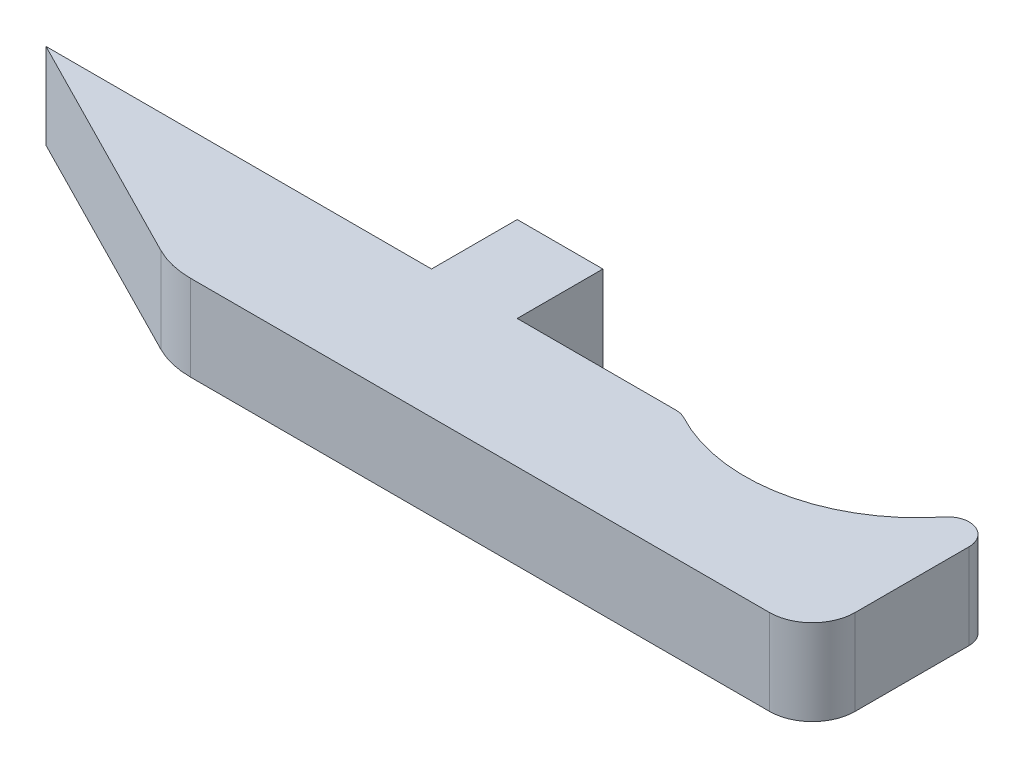
from build123d import *

# Parameters (mm, degrees)
BOSS_EXTRUDE1_DEPTH = 6.35
FILLET1_R           = 1.5875
FILLET2_R           = 6.35
FILLET3_R           = 3.175
SKETCH6_W           = 6.35
SKETCH6_H           = 6.35
BOSS_EXTRUDE2_DEPTH = 6.35


with BuildPart() as part:
    # Sketch1 → Boss-Extrude1 (new body)
    with BuildSketch(Plane(origin=(0, 0, 0), x_dir=(1, 0, 0), z_dir=(0, 1, 0))):
        with BuildLine():
            ThreePointArc((71.8451, -2.691968416), (65.44608311, -13.792101845), (52.633598926, -13.817168416))
            Line((52.633598926, -13.817168416), (5.5225, -13.817168416))
            Line((5.5225, -13.817168416), (24.2201, -23.342168416))
            Line((24.2201, -23.342168416), (71.8451, -23.342168416))
            Line((71.8451, -23.342168416), (71.8451, -2.691968416))
        make_face()
    extrude(amount=BOSS_EXTRUDE1_DEPTH)

    # Fillet1
    fillet1_edges = [part.edges().sort_by_distance(p)[0] for p in [
        (71.8451, 3.175, 2.691968416),
        (52.633598926, 3.175, 13.817168416),
    ]]
    fillet(fillet1_edges, radius=FILLET1_R)

    # Fillet2
    fillet2_edges = [part.edges().sort_by_distance(p)[0] for p in [
        (24.2201, 3.175, 23.342168416),
    ]]
    fillet(fillet2_edges, radius=FILLET2_R)

    # Fillet3
    fillet3_edges = [part.edges().sort_by_distance(p)[0] for p in [
        (71.8451, 3.175, 23.342168416),
    ]]
    fillet(fillet3_edges, radius=FILLET3_R)

    # Sketch6 → Boss-Extrude2 (add)
    with BuildSketch(Plane(origin=(0, 0, 13.817168416), x_dir=(-1, 0, 0), z_dir=(0, 0, -1))):
        with Locations((-37.2725, 3.175)):
            Rectangle(SKETCH6_W, SKETCH6_H)
    extrude(amount=BOSS_EXTRUDE2_DEPTH)


solid = part.part
